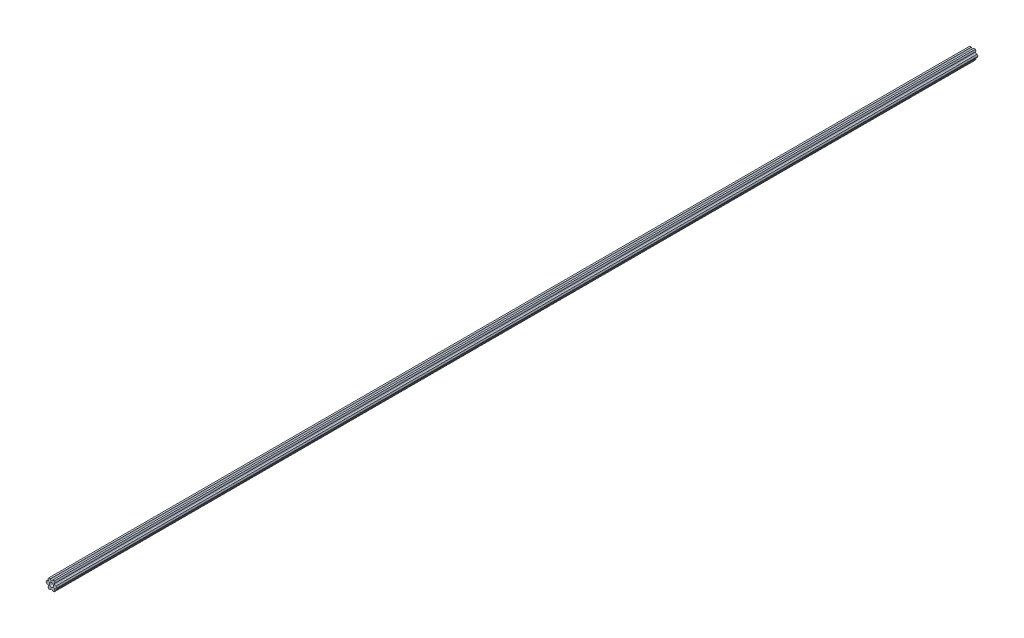
from build123d import *

# Parameters (mm, degrees)
SKETCH1_R           = 2.159
BOSS_EXTRUDE1_DEPTH = 914.4


with BuildPart() as part:
    # Sketch1 → Boss-Extrude1 (new body)
    with BuildSketch(Plane.XY):
        with BuildLine():
            Line((3.536053372, 3.273375901), (2.712968915, 4.699))
            Line((2.712968915, 4.699), (1.0668, 4.699))
            ThreePointArc((1.0668, 4.699), (0, 3.6322), (-1.0668, 4.699))
            Line((-1.0668, 4.699), (-2.712968915, 4.699))
            Line((-2.712968915, 4.699), (-3.536053372, 3.273375901))
            ThreePointArc((-3.536053372, 3.273375901), (-3.145577472, 1.8161), (-4.602853372, 1.425624099))
            Line((-4.602853372, 1.425624099), (-5.42593783, 0))
            Line((-5.42593783, 0), (-4.602853372, -1.425624099))
            ThreePointArc((-4.602853372, -1.425624099), (-3.145577472, -1.8161), (-3.536053372, -3.273375901))
            Line((-3.536053372, -3.273375901), (-2.712968915, -4.699))
            Line((-2.712968915, -4.699), (-1.0668, -4.699))
            ThreePointArc((-1.0668, -4.699), (0, -3.6322), (1.0668, -4.699))
            Line((1.0668, -4.699), (2.712968915, -4.699))
            Line((2.712968915, -4.699), (3.536053372, -3.273375901))
            ThreePointArc((3.536053372, -3.273375901), (3.145577472, -1.8161), (4.602853372, -1.425624099))
            Line((4.602853372, -1.425624099), (5.42593783, 0))
            Line((5.42593783, 0), (4.602853372, 1.425624099))
            ThreePointArc((4.602853372, 1.425624099), (3.145577472, 1.8161), (3.536053372, 3.273375901))
        make_face()
        Circle(SKETCH1_R, mode=Mode.SUBTRACT)
    extrude(amount=BOSS_EXTRUDE1_DEPTH)


solid = part.part
